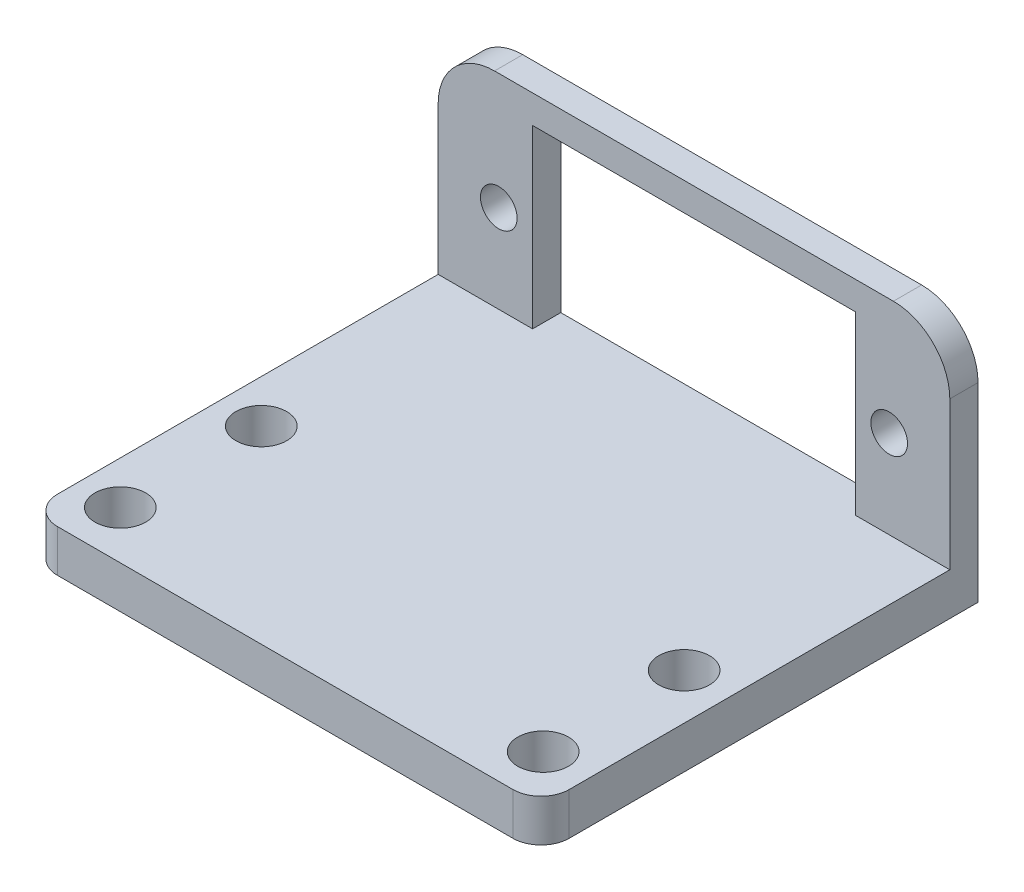
from build123d import *

# Parameters (mm, degrees)
SKETCH1_W            = 36.3
SKETCH1_H            = 16.5
SKETCH1_W_2          = 22.89999
SKETCH1_H_2          = 12.5
BOSS_EXTRUDE1_DEPTH  = 2
FILLET1_R            = 4
M2_CLEARANCE_HOLE1_D = 2.6
SKETCH4_W            = 36.3
SKETCH4_H            = 3
BOSS_EXTRUDE2_DEPTH  = 29
SKETCH4_2_W          = 36.3
SKETCH4_2_H          = 3
BOSS_EXTRUDE3_DEPTH  = 2
FILLET2_R            = 2
M3_CLEARANCE_HOLE1_D = 3.6


with BuildPart() as part:
    # Sketch1 → Boss-Extrude1 (new body)
    with BuildSketch(Plane.XY):
        with Locations((17.65, 8.830531887)):
            Rectangle(SKETCH1_W, SKETCH1_H)
        with Locations((17.65, 8.830531887)):
            Rectangle(SKETCH1_W_2, SKETCH1_H_2, mode=Mode.SUBTRACT)
    extrude(amount=BOSS_EXTRUDE1_DEPTH)

    # Fillet1
    fillet1_edges = [part.edges().sort_by_distance(p)[0] for p in [
        (-0.5, 17.080531887, 1),
        (35.8, 17.080531887, 1),
    ]]
    fillet(fillet1_edges, radius=FILLET1_R)

    # M2 Clearance Hole1 (through all)
    with Locations(Plane.XY.offset(2)):
        with Locations((31.5, 8.830531887), (3.8, 8.830531887)):
            Hole(M2_CLEARANCE_HOLE1_D / 2)

    # Sketch4 → Boss-Extrude2 (add)
    with BuildSketch(Plane.XY.offset(2)):
        with Locations((17.65, 1.080531887)):
            Rectangle(SKETCH4_W, SKETCH4_H)
    extrude(amount=BOSS_EXTRUDE2_DEPTH)

    # Sketch4<2> → Boss-Extrude3 (add)
    with BuildSketch(Plane.XY.offset(2)):
        with Locations((17.65, 1.080531887)):
            Rectangle(SKETCH4_2_W, SKETCH4_2_H)
    extrude(amount=-BOSS_EXTRUDE3_DEPTH)

    # Fillet2
    fillet2_edges = [part.edges().sort_by_distance(p)[0] for p in [
        (-0.5, 1.080531887, 31),
        (35.8, 1.080531887, 31),
    ]]
    fillet(fillet2_edges, radius=FILLET2_R)

    # M3 Clearance Hole1 (through all)
    with Locations(Plane(origin=(0, 2.580531887, 0), x_dir=(1, 0, 0), z_dir=(0, 1, 0))):
        with Locations((2.550005, -17.6), (2.550005, -27.6), (32.550005, -17.6), (32.550005, -27.6)):
            Hole(M3_CLEARANCE_HOLE1_D / 2)


solid = part.part
